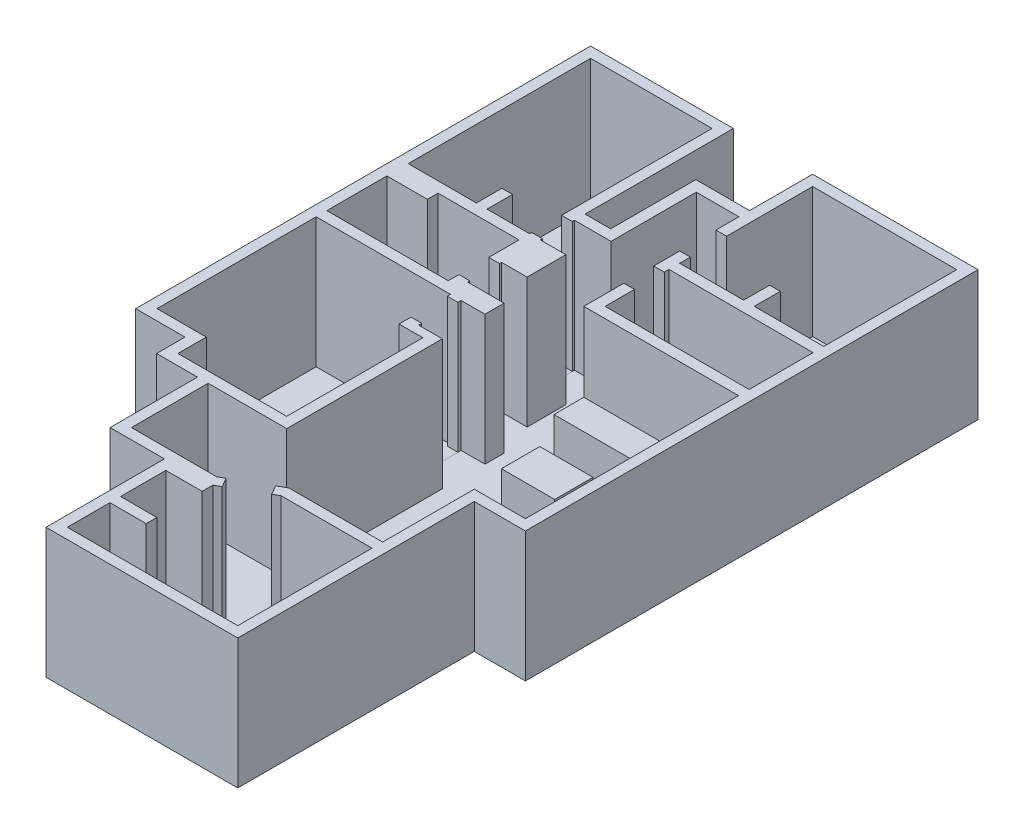
from build123d import *

# Parameters (mm, degrees)
BOSS_EXTRUDE1_DEPTH   = 100
BOSS_EXTRUDE1_2_DEPTH = 100
BOSS_EXTRUDE1_3_DEPTH = 100
BOSS_EXTRUDE1_4_DEPTH = 100
BOSS_EXTRUDE1_5_DEPTH = 100
BOSS_EXTRUDE1_6_DEPTH = 100
BOSS_EXTRUDE2_DEPTH   = 100
SKETCH1_5_W           = 1600
SKETCH1_5_H           = 597
BOSS_EXTRUDE4_DEPTH   = 100
SKETCH1_5_W_2         = 1630
SKETCH1_5_H_2         = 610
BOSS_EXTRUDE4_2_DEPTH = 100
SKETCH1_5_W_3         = 2554.3
SKETCH1_5_H_3         = 666.27418911
BOSS_EXTRUDE4_3_DEPTH = 100
SKETCH1_5_W_4         = 851
SKETCH1_5_H_4         = 1062.419459944
BOSS_EXTRUDE4_4_DEPTH = 100
BOSS_EXTRUDE3_DEPTH   = 3048
SKETCH5_W             = 1250
SKETCH5_H             = 900
BOSS_EXTRUDE7_DEPTH   = 1200
SKETCH5_3_W           = 950
SKETCH5_3_H           = 1410
SKETCH5_3_W_2         = 750
SKETCH5_3_H_2         = 1210
BOSS_EXTRUDE9_DEPTH   = 800
SKETCH5_4_W           = 950
SKETCH5_4_H           = 1500
SKETCH5_4_W_2         = 750
SKETCH5_4_H_2         = 1300
BOSS_EXTRUDE10_DEPTH  = 800


with BuildPart() as part:
    # Sketch1 → Boss-Extrude1 (new body)
    with BuildSketch(Plane(origin=(0, 0, 0), x_dir=(1, 0, 0), z_dir=(0, 1, 0))):
        Polygon((2850, 0), (0, 0), (0, -3683), (1850, -3683), (1850, -4280), (2850, -4280), (2850, -4230), (3100, -4230), (3100, -3530), (2850, -3530), align=None)
    extrude(amount=BOSS_EXTRUDE1_DEPTH)


with BuildPart() as body_2:
    # Sketch1 → Boss-Extrude1 2 (new body)
    with BuildSketch(Plane(origin=(0, 0, 0), x_dir=(1, 0, 0), z_dir=(0, 1, 0))):
        Polygon((5210, -2020), (4960, -2020), (4960, -2870), (5210, -2870), (5210, -3120), (6710, -3120), (6710, -2510), (8590, -2510), (8590, 0), (5210, 0), align=None)
    extrude(amount=BOSS_EXTRUDE1_2_DEPTH)


with BuildPart() as body_3:
    # Sketch1 → Boss-Extrude1 3 (new body)
    with BuildSketch(Plane(origin=(0, 0, 0), x_dir=(1, 0, 0), z_dir=(0, 1, 0))):
        Polygon((3100, -5940), (3100, -5240), (2850, -5240), (2850, -4530), (950, -4530), (950, -4780), (0, -4780), (0, -6190), (2850, -6190), (2850, -5940), align=None)
    extrude(amount=BOSS_EXTRUDE1_3_DEPTH)

    # Sketch5<3> → Boss-Extrude9 (add)
    with BuildSketch(Plane(origin=(0, 100, 0), x_dir=(1, 0, 0), z_dir=(0, 1, 0))):
        with Locations((475, -5485)):
            Rectangle(SKETCH5_3_W, SKETCH5_3_H)
        with Locations((475, -5485)):
            Rectangle(SKETCH5_3_W_2, SKETCH5_3_H_2, mode=Mode.SUBTRACT)
    extrude(amount=BOSS_EXTRUDE9_DEPTH)


with BuildPart() as body_4:
    # Sketch1 → Boss-Extrude1 4 (new body)
    with BuildSketch(Plane(origin=(0, 0, 0), x_dir=(1, 0, 0), z_dir=(0, 1, 0))):
        Polygon((5210, -3480), (4960, -3480), (4960, -4180), (5210, -4180), (5210, -4870), (8590, -4870), (8590, -3370), (5210, -3370), align=None)
    extrude(amount=BOSS_EXTRUDE1_4_DEPTH)

    # Sketch5<4> → Boss-Extrude10 (add)
    with BuildSketch(Plane(origin=(0, 100, 0), x_dir=(1, 0, 0), z_dir=(0, 1, 0))):
        with Locations((8115, -4120)):
            Rectangle(SKETCH5_4_W, SKETCH5_4_H)
        with Locations((8115, -4120)):
            Rectangle(SKETCH5_4_W_2, SKETCH5_4_H_2, mode=Mode.SUBTRACT)
    extrude(amount=BOSS_EXTRUDE10_DEPTH)


with BuildPart() as body_5:
    # Sketch1 → Boss-Extrude1 5 (new body)
    with BuildSketch(Plane(origin=(0, 0, 0), x_dir=(1, 0, 0), z_dir=(0, 1, 0))):
        Polygon((3401.2, -7365), (3401.2, -6515), (3151.2, -6515), (3151.2, -6440), (0, -6440), (0, -10173.8), (3710, -10173.8), (3710, -7646.5), (3151.2, -7646.5), (3151.2, -7365), align=None)
    extrude(amount=BOSS_EXTRUDE1_5_DEPTH)


with BuildPart() as body_6:
    # Sketch1 → Boss-Extrude1 6 (new body)
    with BuildSketch(Plane(origin=(0, 0, 0), x_dir=(1, 0, 0), z_dir=(0, 1, 0))):
        Polygon((5117.054445662, -12600.790270028), (4992.054445662, -12384.283919082), (4255.932852446, -12809.283919082), (4380.932852446, -13025.790270028), (4241, -13106.580540056), (4241, -14669), (3390, -14669), (3390, -15669), (7390, -15669), (7390, -12520), (5256.987298108, -12520), align=None)
    extrude(amount=BOSS_EXTRUDE1_6_DEPTH)


with BuildPart() as body_7:
    # Sketch1<4> → Boss-Extrude2 (new body)
    with BuildSketch(Plane(origin=(0, 0, 0), x_dir=(1, 0, 0), z_dir=(0, 1, 0))):
        Polygon((3100, -3480), (3100, -3530), (3100, -4230), (3100, -4280), (3700, -4280), (3700, -5190), (3100, -5190), (3100, -5240), (3100, -5940), (3100, -5990), (3960, -5990), (3960, -6440), (3401.2, -6440), (3401.2, -6515), (3401.2, -7365), (3401.2, -7440), (3960, -7440), (3960, -11090.07418911), (2116, -11090.07418911), (2116, -12890.07418911), (4116, -12890.07418911), (4255.932852446, -12809.283919082), (4992.054445662, -12384.283919082), (5190, -12270), (7390, -12270), (7390, -10120), (8590, -10120), (8590, -5120), (4960, -5120), (4960, -4180), (4960, -3480), (4960, -2870), (4960, -2020), (4960, -1480), (3960, -1480), (3960, -3480), align=None)
    extrude(amount=BOSS_EXTRUDE2_DEPTH)

    # Sketch5 → Boss-Extrude7 (add)
    with BuildSketch(Plane(origin=(0, 100, 0), x_dir=(1, 0, 0), z_dir=(0, 1, 0))):
        Polygon((7890, -7120), (8590, -7120), (8590, -5120), (4960, -5120), (4960, -5820), (7890, -5820), align=None)
        with Locations((6069.761930509, -7087.980495763)):
            Rectangle(SKETCH5_W, SKETCH5_H)
    extrude(amount=BOSS_EXTRUDE7_DEPTH)


with BuildPart() as body_8:
    # Sketch1<5> → Boss-Extrude4 (new body)
    with BuildSketch(Plane(origin=(0, 0, 0), x_dir=(1, 0, 0), z_dir=(0, 1, 0))):
        with Locations((800, -3981.5)):
            Rectangle(SKETCH1_5_W, SKETCH1_5_H)
    extrude(amount=BOSS_EXTRUDE4_DEPTH)


with BuildPart() as body_9:
    # Sketch1<5> → Boss-Extrude4 2 (new body)
    with BuildSketch(Plane(origin=(0, 0, 0), x_dir=(1, 0, 0), z_dir=(0, 1, 0))):
        with Locations((7775, -2815)):
            Rectangle(SKETCH1_5_W_2, SKETCH1_5_H_2)
    extrude(amount=BOSS_EXTRUDE4_2_DEPTH)


with BuildPart() as body_10:
    # Sketch1<5> → Boss-Extrude4 3 (new body)
    with BuildSketch(Plane(origin=(0, 0, 0), x_dir=(1, 0, 0), z_dir=(0, 1, 0))):
        with Locations((2432.85, -10506.937094555)):
            Rectangle(SKETCH1_5_W_3, SKETCH1_5_H_3)
    extrude(amount=BOSS_EXTRUDE4_3_DEPTH)


with BuildPart() as body_11:
    # Sketch1<5> → Boss-Extrude4 4 (new body)
    with BuildSketch(Plane(origin=(0, 0, 0), x_dir=(1, 0, 0), z_dir=(0, 1, 0))):
        with Locations((3815.5, -13887.790270028)):
            Rectangle(SKETCH1_5_W_4, SKETCH1_5_H_4)
    extrude(amount=BOSS_EXTRUDE4_4_DEPTH)


with BuildPart() as body_12:
    # Sketch2 → Boss-Extrude3 (new body)
    with BuildSketch(Plane(origin=(0, 100, 0), x_dir=(1, 0, 0), z_dir=(0, 1, 0))):
        Polygon((-250, 250), (-250, -10423.8), (905.7, -10423.8), (905.7, -11090.07418911), (1866, -11090.07418911), (1866, -13140.07418911), (3140, -13140.07418911), (3140, -15919), (7640, -15919), (7640, -10370), (8840, -10370), (8840, 250), (4960, 250), (4960, -1230), (3700, -1230), (3700, -3230), (3100, -3230), (3100, 250), align=None)
        Polygon((4960, -2020), (5210, -2020), (5210, 0), (8590, 0), (8590, -3120), (6960, -3120), (6960, -2510), (6710, -2510), (6710, -3120), (5210, -3120), (5210, -2870), (4960, -2870), (4960, -3480), (5210, -3480), (5210, -3370), (8590, -3370), (8590, -4870), (5210, -4870), (5210, -4180), (4960, -4180), (4960, -5120), (8590, -5120), (8590, -10120), (7390, -10120), (7390, -12270), (5190, -12270), (4992.054445662, -12384.283919082), (5117.054445662, -12600.790270028), (5256.987298108, -12520), (7390, -12520), (7390, -15669), (3390, -15669), (3390, -14669), (4241, -14669), (4241, -14419), (3390, -14419), (3390, -13356.580540056), (4241, -13356.580540056), (4241, -13106.580540056), (4380.932852446, -13025.790270028), (4255.932852446, -12809.283919082), (4116, -12890.07418911), (2116, -12890.07418911), (2116, -11090.07418911), (3960, -11090.07418911), (3960, -7440), (3401.2, -7440), (3401.2, -7365), (3151.2, -7365), (3151.2, -7646.5), (3710, -7646.5), (3710, -10840.07418911), (1155.7, -10840.07418911), (1155.7, -10173.8), (0, -10173.8), (0, -6440), (3151.2, -6440), (3151.2, -6515), (3401.2, -6515), (3401.2, -6440), (3960, -6440), (3960, -5990), (3100, -5990), (3100, -5940), (2850, -5940), (2850, -6190), (0, -6190), (0, -4780), (950, -4780), (950, -4530), (2850, -4530), (2850, -5240), (3100, -5240), (3100, -5190), (3700, -5190), (3700, -4280), (3100, -4280), (3100, -4230), (2850, -4230), (2850, -4280), (1850, -4280), (1850, -3683), (1600, -3683), (1600, -4280), (0, -4280), (0, 0), (2850, 0), (2850, -3530), (3100, -3530), (3100, -3480), (3960, -3480), (3960, -1480), (4960, -1480), align=None, mode=Mode.SUBTRACT)
    extrude(amount=BOSS_EXTRUDE3_DEPTH)


solid = Compound([part.part, body_2.part, body_3.part, body_4.part, body_5.part, body_6.part, body_7.part, body_8.part, body_9.part, body_10.part, body_11.part, body_12.part])
